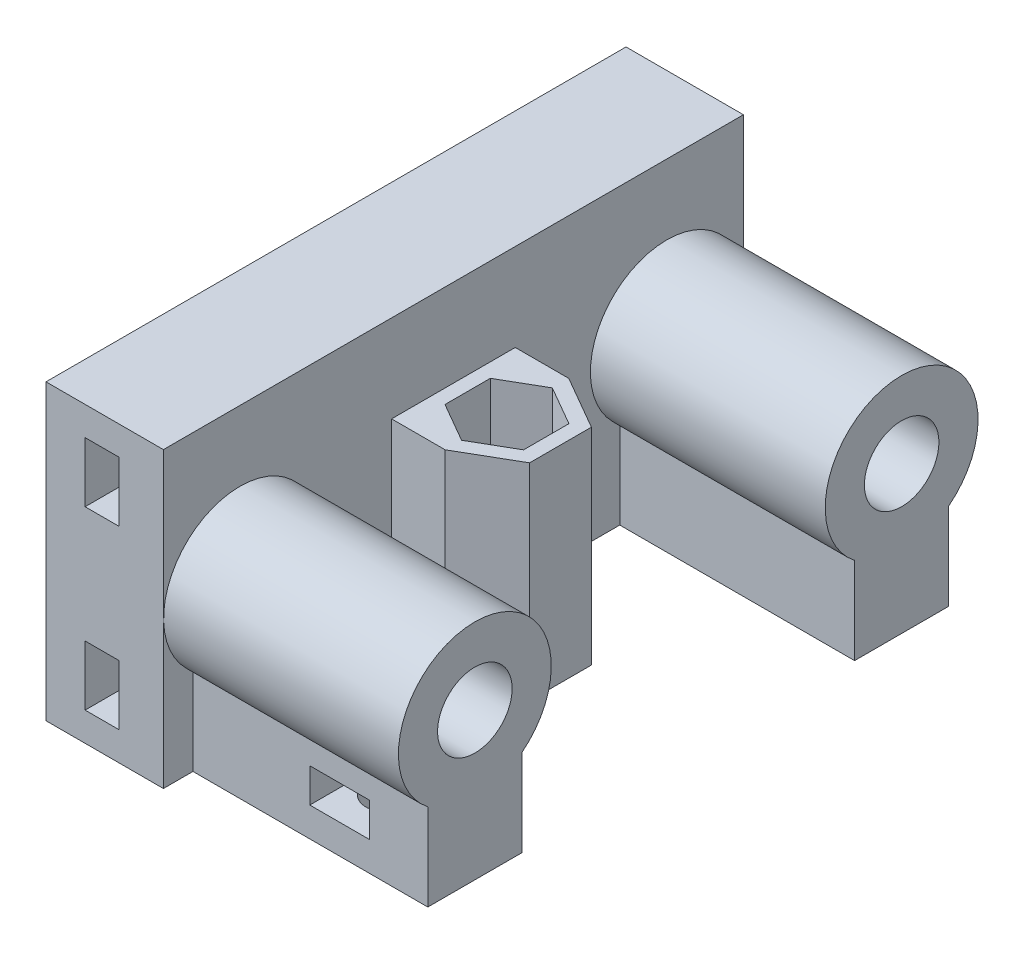
from build123d import *

# Parameters (mm, degrees)
SKETCH1_W               = 88.9
SKETCH1_H               = 76.2
BOSS_EXTRUDE1_DEPTH     = 25.4
SKETCH2_R               = 4.1021
CUT_EXTRUDE1_DEPTH      = 19.05
SKETCH5_W               = 88.9
SKETCH5_H               = 0.127
BOSS_EXTRUDE2_DEPTH     = 50.8
SKETCH6_R               = 16.53116582
SKETCH6_R_2             = 8.0645
BOSS_EXTRUDE3_DEPTH     = 50.8
BOSS_EXTRUDE4_DEPTH     = 18.288
SKETCH8_W               = 50.8
SKETCH8_H               = 20.36233164
BOSS_EXTRUDE5_DEPTH     = 27.94
CUT_EXTRUDE6_REACH      = 153.994
CUT_EXTRUDE6_END_RADIUS = 8.0645
SKETCH13_W              = 6.477
SKETCH13_H              = 7.366
CUT_EXTRUDE7_DEPTH      = 22.9616
BOSS_EXTRUDE6_DEPTH     = 50.8
CUT_EXTRUDE8_REACH      = 153.93
SKETCH14_3_R            = 5.25
CUT_EXTRUDE9_DEPTH      = 9
CUT_EXTRUDE10_REACH     = 153.93
SKETCH16_W              = 50.8
SKETCH16_H              = 6.39233418
BOSS_EXTRUDE7_DEPTH     = 50.8
BOSS_EXTRUDE9_START     = 19.05
BOSS_EXTRUDE9_DEPTH     = 19.05
SKETCH22_W              = 7.366
SKETCH22_H              = 12.954
CUT_EXTRUDE15_DEPTH     = 28.4988
MIRROR5_START           = 19.05
MIRROR5_COPY_1_DEPTH    = 19.05
MIRROR5_COPY_2_SKETCH_W = 7.366
MIRROR5_COPY_2_SKETCH_H = 12.954
MIRROR5_COPY_2_DEPTH    = 28.4988
SKETCH25_R              = 5.125
BOSS_EXTRUDE10_DEPTH    = 6.35
SKETCH26_W              = 25.4
SKETCH26_H              = 125.476
CUT_EXTRUDE16_DEPTH     = 6.35
CUT_EXTRUDE17_DEPTH     = 6.35


with BuildPart() as part:
    # Sketch1 → Boss-Extrude1 (new body)
    with BuildSketch(Plane(origin=(0, 0, 0), x_dir=(0, 0, -1), z_dir=(1, 0, 0))):
        with Locations((44.45, 38.1)):
            Rectangle(SKETCH1_W, SKETCH1_H)
    extrude(amount=BOSS_EXTRUDE1_DEPTH)

    # Sketch2 → Cut-Extrude1 (cut)
    with BuildSketch(Plane.ZY):
        with Locations((-85.09, 19.05)):
            Circle(SKETCH2_R)
        with Locations((-3.81, 57.15)):
            Circle(SKETCH2_R)
        with Locations((-3.81, 19.05)):
            Circle(SKETCH2_R)
        with Locations((-85.09, 57.15)):
            Circle(SKETCH2_R)
    extrude(amount=-CUT_EXTRUDE1_DEPTH, mode=Mode.SUBTRACT)

    # Sketch5 → Boss-Extrude2 (add)
    with BuildSketch(Plane(origin=(25.4, 0, 0), x_dir=(0, 0, -1), z_dir=(1, 0, 0))):
        with Locations((44.45, 0.0635)):
            Rectangle(SKETCH5_W, SKETCH5_H)
    extrude(amount=BOSS_EXTRUDE2_DEPTH)

    # Sketch6 → Boss-Extrude3 (add)
    # profile 1 of 2: a face of its own
    with BuildSketch(Plane(origin=(25.4, 0, 0), x_dir=(0, 0, -1), z_dir=(1, 0, 0))):
        with Locations(Location((-1.7145, 38.1635, 0), (0, 0, 275.953033203))):
            Circle(SKETCH6_R)
        with Locations(Location((-1.7145, 38.1635, 0), (0, 0, 77.725329785))):
            Circle(SKETCH6_R_2, mode=Mode.SUBTRACT)
    # profile 2 of 2: a face of its own
    with BuildSketch(Plane(origin=(25.4, 0, 0), x_dir=(0, 0, -1), z_dir=(1, 0, 0))):
        with Locations(Location((90.6145, 38.1635, 0), (0, 0, 264.046966797))):
            Circle(SKETCH6_R)
        with Locations(Location((90.6145, 38.1635, 0), (0, 0, 102.274670215))):
            Circle(SKETCH6_R_2, mode=Mode.SUBTRACT)
    extrude(amount=BOSS_EXTRUDE3_DEPTH)

    # Sketch7 → Boss-Extrude4 (add)
    with BuildSketch(Plane.XY):
        Polygon((76.2, 0.127), (25.4, 0.127), (25.4, 76.2), (0, 76.2), (0, 58.670238274), (19.05, 58.670238274), (19.05, 55.629761726), (0, 55.629761726), (0, 20.570238274), (19.05, 20.570238274), (19.05, 17.529761726), (0, 17.529761726), (0, 0), (76.2, 0), align=None)
    boss_extrude4 = extrude(amount=BOSS_EXTRUDE4_DEPTH)

    # Mirror2: Boss-Extrude4 across plane
    add(boss_extrude4.mirror(Plane.XY.offset(-44.45)))

    # Sketch8 → Boss-Extrude5 (add)
    with BuildSketch(Plane(origin=(0, 0.127, 0), x_dir=(1, 0, 0), z_dir=(0, 1, 0))):
        with Locations((50.8, -1.7145)):
            Rectangle(SKETCH8_W, SKETCH8_H)
    boss_extrude5 = extrude(amount=BOSS_EXTRUDE5_DEPTH)

    # Cut-Extrude6: up to this cylinder (the profile starts outside it)
    cut_extrude6_end = Plane(origin=(57.15, 38.1635, 1.7145), z_dir=(-1, 0, 0)) * Cylinder(CUT_EXTRUDE6_END_RADIUS, 325.117, mode=Mode.PRIVATE)
    # Sketch12 → Cut-Extrude6 (cut, up to the surface)
    with BuildSketch(Plane.XZ, mode=Mode.PRIVATE) as cut_extrude6_sk1:
        with BuildLine():
            ThreePointArc((52.6669, 1.7145), (57.15, -2.7686), (61.6331, 1.7145))
            Line((61.6331, 1.7145), (52.6669, 1.7145))
        make_face()
    cut_extrude6_tool1 = extrude(cut_extrude6_sk1.sketch, amount=-CUT_EXTRUDE6_REACH, mode=Mode.PRIVATE) - cut_extrude6_end
    # Sketch12 → Cut-Extrude6 (cut, up to the surface)
    with BuildSketch(Plane.XZ, mode=Mode.PRIVATE) as cut_extrude6_sk2:
        with BuildLine():
            Line((52.6669, 1.7145), (61.6331, 1.7145))
            ThreePointArc((61.6331, 1.7145), (57.15, 6.1976), (52.6669, 1.7145))
        make_face()
    cut_extrude6_tool2 = extrude(cut_extrude6_sk2.sketch, amount=-CUT_EXTRUDE6_REACH, mode=Mode.PRIVATE) - cut_extrude6_end
    # Sketch12 → Cut-Extrude6 (cut, up to the surface)
    with BuildSketch(Plane.XZ, mode=Mode.PRIVATE) as cut_extrude6_sk3:
        with BuildLine():
            ThreePointArc((52.6669, 1.7145), (57.15, -2.7686), (61.6331, 1.7145))
            Line((61.6331, 1.7145), (52.6669, 1.7145))
        make_face()
    cut_extrude6_tool3 = extrude(cut_extrude6_sk3.sketch, amount=-CUT_EXTRUDE6_REACH, mode=Mode.PRIVATE) - cut_extrude6_end
    # Sketch12 → Cut-Extrude6 (cut, up to the surface)
    with BuildSketch(Plane.XZ, mode=Mode.PRIVATE) as cut_extrude6_sk4:
        with BuildLine():
            Line((52.6669, 1.7145), (61.6331, 1.7145))
            ThreePointArc((61.6331, 1.7145), (57.15, 6.1976), (52.6669, 1.7145))
        make_face()
    cut_extrude6_tool4 = extrude(cut_extrude6_sk4.sketch, amount=-CUT_EXTRUDE6_REACH, mode=Mode.PRIVATE) - cut_extrude6_end
    cut_extrude6 = cut_extrude6_tool1.solids().sort_by_distance((57.15, 0, -0.188187))[0] + cut_extrude6_tool2.solids().sort_by_distance((57.15, 0, 3.617187))[0] + cut_extrude6_tool3.solids().sort_by_distance((57.15, 0, -0.188187))[0] + cut_extrude6_tool4.solids().sort_by_distance((57.15, 0, 3.617187))[0]
    add(cut_extrude6, mode=Mode.SUBTRACT)

    # Sketch13 → Cut-Extrude7 (cut)
    with BuildSketch(Plane.XY.offset(18.288)):
        with Locations((60.3885, 16.383)):
            Rectangle(SKETCH13_W, SKETCH13_H)
        with Locations((53.9115, 16.383)):
            Rectangle(SKETCH13_W, SKETCH13_H)
    cut_extrude7 = extrude(amount=-CUT_EXTRUDE7_DEPTH, mode=Mode.SUBTRACT)

    # Mirror3: Boss-Extrude5, Cut-Extrude6, Cut-Extrude7 across plane
    add(boss_extrude5.mirror(Plane.XY.offset(-44.45)))
    add(cut_extrude6.mirror(Plane.XY.offset(-44.45)), mode=Mode.SUBTRACT)
    add(cut_extrude7.mirror(Plane.XY.offset(-44.45)), mode=Mode.SUBTRACT)

    # Sketch14 → Boss-Extrude6 (add)
    with BuildSketch(Plane(origin=(0, 0.127, 0), x_dir=(1, 0, 0), z_dir=(0, 1, 0))):
        Polygon((48.563230368, 37.763351356), (48.563230368, 51.136648644), (36.981615184, 57.823297288), (25.4, 51.136648644), (25.4, 37.763351356), (36.981615184, 31.076702712), align=None)
        Polygon((28.481615184, 49.357477288), (28.481615184, 39.542522712), (36.981615184, 34.635045424), (45.481615184, 39.542522712), (45.481615184, 49.357477288), (36.981615184, 54.264954576), align=None, mode=Mode.SUBTRACT)
    extrude(amount=BOSS_EXTRUDE6_DEPTH)

    # Sketch14<3> → Cut-Extrude8 (cut, up to next)
    with BuildSketch(Plane(origin=(0, 0.127, 0), x_dir=(1, 0, 0), z_dir=(0, 1, 0)), mode=Mode.PRIVATE) as cut_extrude8_sk1:
        with Locations(Location((36.981615184, 44.45, 0), (0, 0, 270))):
            Circle(SKETCH14_3_R)
    cut_extrude8_tool1 = extrude(cut_extrude8_sk1.sketch, amount=-CUT_EXTRUDE8_REACH, mode=Mode.PRIVATE) & part.part
    add(cut_extrude8_tool1.solids().sort_by_distance((36.981615, 0.127, -44.45))[0], mode=Mode.SUBTRACT)

    # Sketch15 → Cut-Extrude9 (cut)
    with BuildSketch(Plane.XZ):
        Polygon((45.531615184, -39.513655198), (36.981615184, -34.577310397), (28.431615184, -39.513655198), (28.431615184, -49.386344802), (36.981615184, -54.322689603), (45.531615184, -49.386344802), align=None)
    extrude(amount=-CUT_EXTRUDE9_DEPTH, mode=Mode.SUBTRACT)

    # Sketch16 → Cut-Extrude10 (cut, up to next)
    with BuildSketch(Plane(origin=(0, 0.127, 0), x_dir=(1, 0, 0), z_dir=(0, 1, 0)), mode=Mode.PRIVATE) as cut_extrude10_sk1:
        Polygon((48.563230368, 37.763351356), (36.981615184, 31.076702712), (25.4, 31.076702712), (25.4, 8.46666582), (76.2, 8.46666582), (76.2, 80.43333418), (25.4, 80.43333418), (25.4, 57.823297288), (36.981615184, 57.823297288), (48.563230368, 51.136648644), align=None)
    cut_extrude10_tool1 = extrude(cut_extrude10_sk1.sketch, amount=-CUT_EXTRUDE10_REACH, mode=Mode.PRIVATE) & part.part
    # Sketch16 → Cut-Extrude10 (cut, up to next)
    with BuildSketch(Plane(origin=(0, 0.127, 0), x_dir=(1, 0, 0), z_dir=(0, 1, 0)), mode=Mode.PRIVATE) as cut_extrude10_sk2:
        with Locations((50.8, -15.09183291)):
            Rectangle(SKETCH16_W, SKETCH16_H)
    cut_extrude10_tool2 = extrude(cut_extrude10_sk2.sketch, amount=-CUT_EXTRUDE10_REACH, mode=Mode.PRIVATE) & part.part
    # Sketch16 → Cut-Extrude10 (cut, up to next)
    with BuildSketch(Plane(origin=(0, 0.127, 0), x_dir=(1, 0, 0), z_dir=(0, 1, 0)), mode=Mode.PRIVATE) as cut_extrude10_sk3:
        with Locations((50.8, 103.99183291)):
            Rectangle(SKETCH16_W, SKETCH16_H)
    cut_extrude10_tool3 = extrude(cut_extrude10_sk3.sketch, amount=-CUT_EXTRUDE10_REACH, mode=Mode.PRIVATE) & part.part
    add(cut_extrude10_tool1.solids().sort_by_distance((53.397723, 0.127, -44.45))[0], mode=Mode.SUBTRACT)
    add(cut_extrude10_tool2.solids().sort_by_distance((50.8, 0.127, 15.091833))[0], mode=Mode.SUBTRACT)
    add(cut_extrude10_tool3.solids().sort_by_distance((50.8, 0.127, -103.991833))[0], mode=Mode.SUBTRACT)

    # Sketch18 → Boss-Extrude7 (add)
    with BuildSketch(Plane(origin=(0, 0.127, 0), x_dir=(1, 0, 0), z_dir=(0, 1, 0))):
        Polygon((36.981615184, 57.823297288), (25.4, 57.823297288), (25.4, 51.136648644), align=None)
        Polygon((25.4, 37.763351356), (25.4, 31.076702712), (36.981615184, 31.076702712), align=None)
    extrude(amount=BOSS_EXTRUDE7_DEPTH)

    # Sketch20 → Boss-Extrude9 (add)
    with BuildSketch(Plane.ZY.offset(-19.05).offset(BOSS_EXTRUDE9_START)):
        with BuildLine():
            ThreePointArc((0.2921, 19.05), (0.218413175, 18.275976935), (0, 17.529761726))
            Line((0, 17.529761726), (18.288, 17.529761726))
            Line((18.288, 17.529761726), (18.288, 20.570238274))
            Line((18.288, 20.570238274), (0, 20.570238274))
            ThreePointArc((0, 20.570238274), (0.218413175, 19.824023065), (0.2921, 19.05))
        make_face()
    boss_extrude9 = extrude(amount=-BOSS_EXTRUDE9_DEPTH)

    # Sketch22 → Cut-Extrude15 (cut)
    with BuildSketch(Plane.XY.offset(18.288)):
        with Locations((12.1412, 19.05)):
            Rectangle(SKETCH22_W, SKETCH22_H)
    cut_extrude15 = extrude(amount=-CUT_EXTRUDE15_DEPTH, mode=Mode.SUBTRACT)

    # Mirror4: Boss-Extrude9, Cut-Extrude15 across plane
    add(boss_extrude9.mirror(Plane.XY.offset(-44.45)))
    add(cut_extrude15.mirror(Plane.XY.offset(-44.45)), mode=Mode.SUBTRACT)

    # Mirror5: Boss-Extrude9, Cut-Extrude15 across plane
    add(boss_extrude9.mirror(Plane.ZX.offset(38.1)))
    add(cut_extrude15.mirror(Plane.ZX.offset(38.1)), mode=Mode.SUBTRACT)

    # Mirror5 copy 1 sketch → Mirror5 copy 1 (add)
    with BuildSketch(Plane(origin=(19.05, 76.2, -88.9), x_dir=(0, 0, -1), z_dir=(-1, 0, 0)).offset(MIRROR5_START)):
        with BuildLine():
            ThreePointArc((0.2921, 19.05), (0.218413175, 18.275976935), (0, 17.529761726))
            Line((0, 17.529761726), (18.288, 17.529761726))
            Line((18.288, 17.529761726), (18.288, 20.570238274))
            Line((18.288, 20.570238274), (0, 20.570238274))
            ThreePointArc((0, 20.570238274), (0.218413175, 19.824023065), (0.2921, 19.05))
        make_face()
    extrude(amount=-MIRROR5_COPY_1_DEPTH)

    # Mirror5 copy 2 sketch → Mirror5 copy 2 (cut)
    with BuildSketch(Plane(origin=(0, 76.2, -107.188), x_dir=(1, 0, 0), z_dir=(0, 0, -1))):
        with Locations((12.1412, 19.05)):
            Rectangle(MIRROR5_COPY_2_SKETCH_W, MIRROR5_COPY_2_SKETCH_H)
    extrude(amount=-MIRROR5_COPY_2_DEPTH, mode=Mode.SUBTRACT)

    # Sketch25 → Boss-Extrude10 (add)
    with BuildSketch(Plane(origin=(0, 15.350000034, 0), x_dir=(-1, 0, 0), z_dir=(0, -1, 0))):
        Polygon((-36.981615184, 34.577310397), (-28.431615184, 39.513655198), (-28.431615184, 49.386344802), (-36.981615184, 54.322689603), (-45.531615184, 49.386344802), (-45.531615184, 39.513655198), align=None)
        with Locations(Location((-36.981615184, 44.45, 0), (0, 0, 90))):
            Circle(SKETCH25_R, mode=Mode.SUBTRACT)
    extrude(amount=-BOSS_EXTRUDE10_DEPTH)

    # Sketch26 → Cut-Extrude16 (cut)
    with BuildSketch(Plane(origin=(0, 76.2, 0), x_dir=(1, 0, 0), z_dir=(0, 1, 0))):
        with Locations((12.7, 44.45)):
            Rectangle(SKETCH26_W, SKETCH26_H)
    extrude(amount=-CUT_EXTRUDE16_DEPTH, mode=Mode.SUBTRACT)

    # Sketch27 → Cut-Extrude17 (cut)
    with BuildSketch(Plane.XZ):
        Polygon((25.4, -107.188), (25.4, -100.79566582), (76.2, -100.79566582), (76.2, -80.43333418), (25.4, -80.43333418), (25.4, -57.823297288), (36.981615184, -57.823297288), (48.563230368, -51.136648644), (48.563230368, -37.763351356), (36.981615184, -31.076702712), (25.4, -31.076702712), (25.4, -8.46666582), (76.2, -8.46666582), (76.2, 11.89566582), (25.4, 11.89566582), (25.4, 18.288), (0, 18.288), (0, -107.188), align=None)
    extrude(amount=-CUT_EXTRUDE17_DEPTH, mode=Mode.SUBTRACT)


solid = part.part
